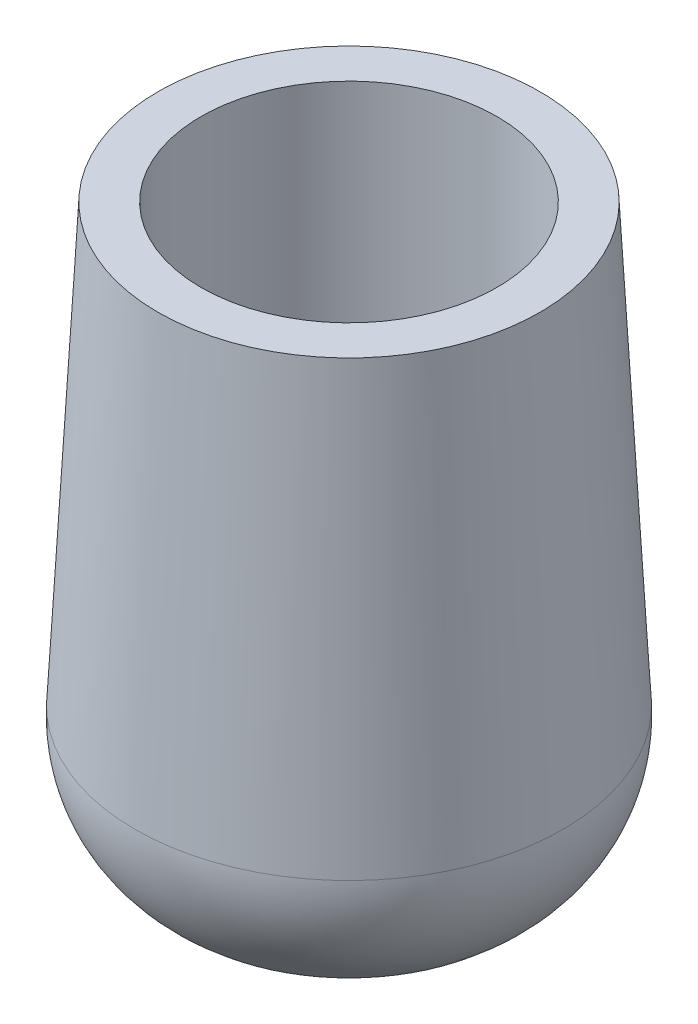
from build123d import *

# Parameters (mm, degrees)
SKETCH2_R          = 4.7625
BASE_EXTRUDE_DEPTH = 12.7
BASE_EXTRUDE_TAPER = 3
FILLET1_R          = 3.175
SKETCH3_R          = 3.175
CUT_EXTRUDE1_DEPTH = 6.35


with BuildPart() as part:
    # Sketch2 → Base-Extrude (new body)
    with BuildSketch(Plane(origin=(0, 0, 0), x_dir=(1, 0, 0), z_dir=(0, 1, 0))):
        Circle(SKETCH2_R)
    extrude(amount=BASE_EXTRUDE_DEPTH, taper=BASE_EXTRUDE_TAPER)

    # Fillet1
    fillet1_edges = [part.edges().sort_by_distance(p)[0] for p in [
        (-4.7625, 0, 0),
    ]]
    fillet(fillet1_edges, radius=FILLET1_R)

    # Sketch3 → Cut-Extrude1 (cut)
    with BuildSketch(Plane(origin=(0, 12.7, 0), x_dir=(-1, 0, 0), z_dir=(0, 1, 0))):
        with Locations(Location((0, 0, 0), (0, 0, 90))):
            Circle(SKETCH3_R)
    extrude(amount=-CUT_EXTRUDE1_DEPTH, mode=Mode.SUBTRACT)


solid = part.part
